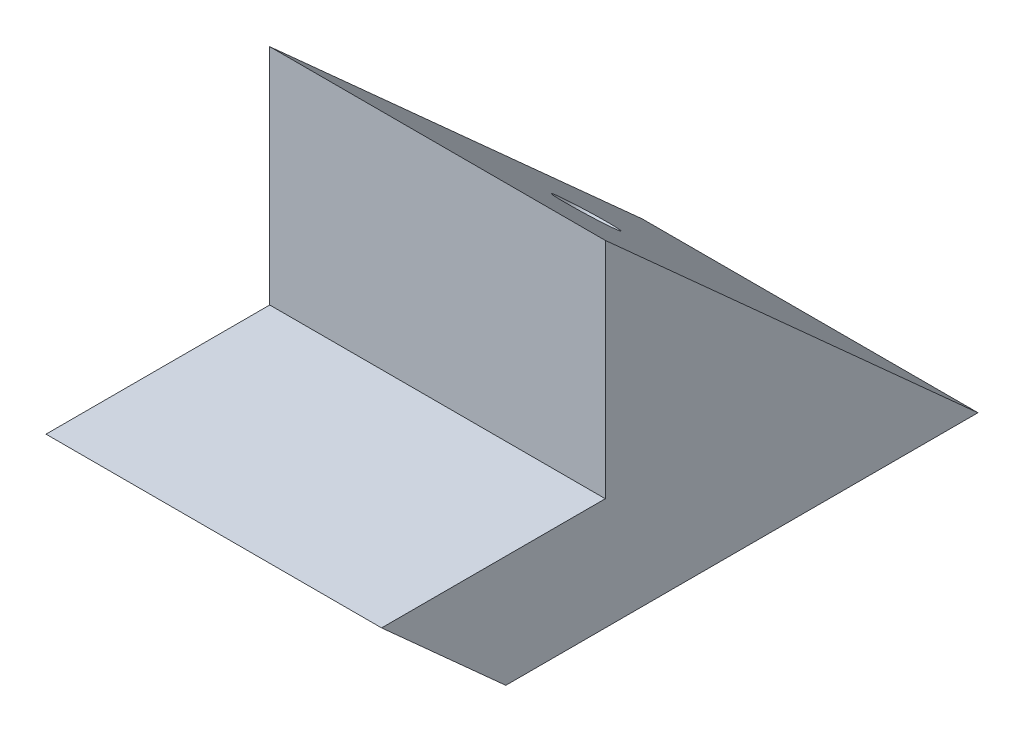
from build123d import *

# Parameters (mm, degrees)
BOSS_EXTRU_1_DEPTH      = 30
ESQUISSE2_R             = 2.5
ENL_V_MAT_EXTRU_1_DEPTH = 54.945473789
ESQUISSE4_R             = 4.5
ENL_V_MAT_EXTRU_2_DEPTH = 57.869272391


with BuildPart() as part:
    # Esquisse1 → Boss.-Extru.1 (new body)
    with BuildSketch(Plane(origin=(0, 0, 0), x_dir=(0, 0, -1), z_dir=(1, 0, 0))):
        Polygon((0, 0), (33.318375445, -30), (-8.893874852, -30), (-20, -20), (0, -20), align=None)
    extrude(amount=BOSS_EXTRU_1_DEPTH)

    # Esquisse2 → Enlèv. mat.-Extru.1 (cut, through all)
    with BuildSketch(Plane(origin=(0, 0, 0), x_dir=(1, 0, 0), z_dir=(0, 0.7431448254773982, -0.6691306063588538))):
        with Locations(Location((15, 17.867207619, 0), (0, 0, 270))):
            Circle(ESQUISSE2_R)
    extrude(amount=-ENL_V_MAT_EXTRU_1_DEPTH, mode=Mode.SUBTRACT)

    # Esquisse4 → Enlèv. mat.-Extru.2 (cut, through all)
    with BuildSketch(Plane(origin=(0, -13.376606859, 12.044350914), x_dir=(1, 0, 0), z_dir=(0, 0.7431448254773982, -0.6691306063588538))):
        with Locations(Location((15, 17.867207619, 0), (0, 0, 270))):
            Circle(ESQUISSE4_R)
    extrude(amount=-ENL_V_MAT_EXTRU_2_DEPTH, mode=Mode.SUBTRACT)


solid = part.part
